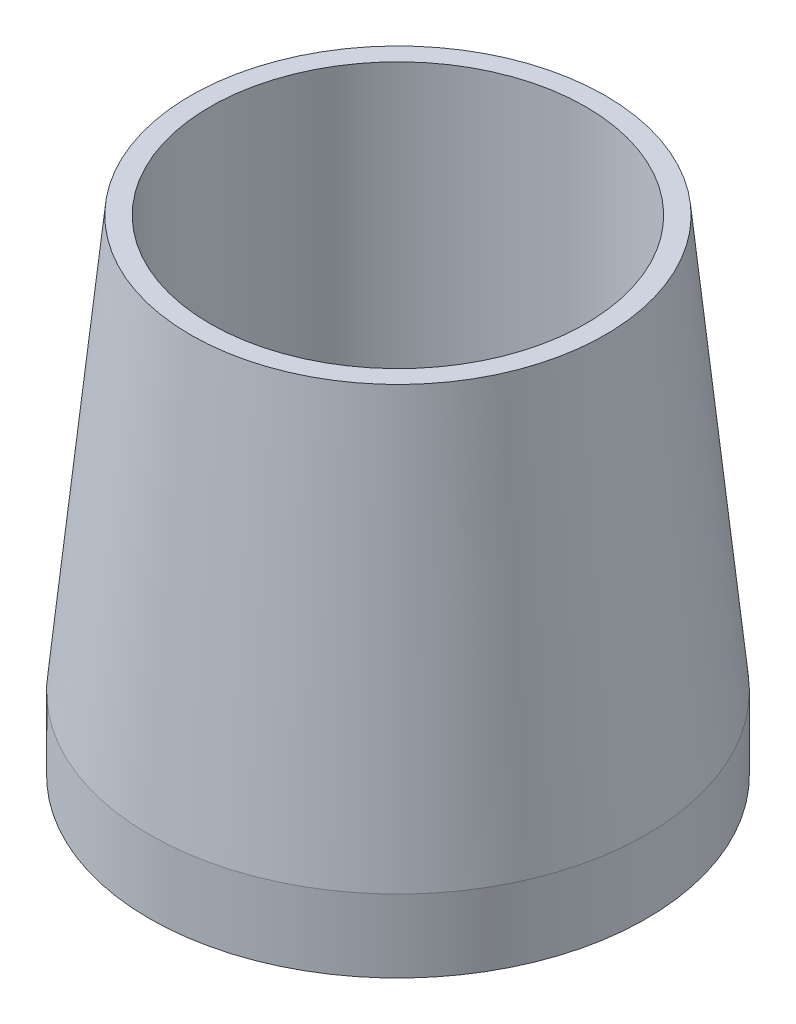
from build123d import *

# Parameters (mm, degrees)
SKETCH2_R          = 1.5
CUT_EXTRUDE1_DEPTH = 13.350354246


with BuildPart() as part:
    # Sketch1 → Revolve1 (revolve)
    with BuildSketch(Plane.YZ):
        Polygon((0, 0), (0, 5.125), (1.5, 5.125), (10, 4.275), (10, 3.875), (1.5, 3.875), (1.5, 0), align=None)
    revolve(axis=Axis((0, 1.5, 0), (0, -1, 0)))

    # Sketch2 → Cut-Extrude1 (cut, through all)
    with BuildSketch(Plane.XZ):
        with Locations(Location((0, 0, 0), (0, 0, 270))):
            Circle(SKETCH2_R)
    extrude(amount=-CUT_EXTRUDE1_DEPTH, mode=Mode.SUBTRACT)


solid = part.part
